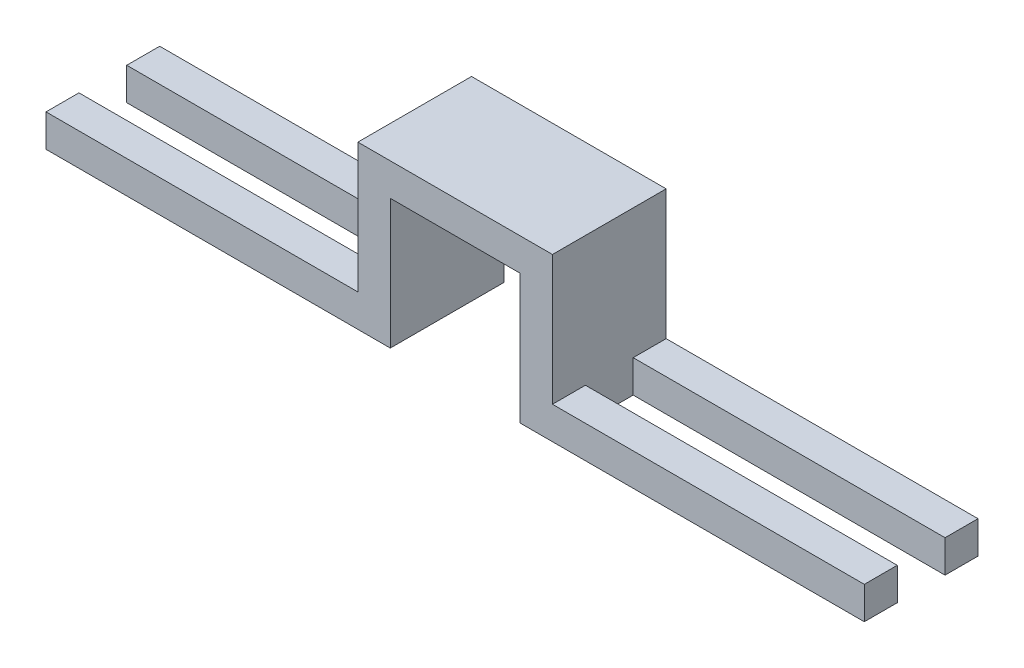
from build123d import *

# Parameters (mm, degrees)
BOSS_EXTRUDE1_DEPTH     = 17.526
CUT_EXTRUDE1_DEPTH      = 69.450165313
CUT_EXTRUDE1_DEPTH_BACK = 69.450165313
SKETCH2_W               = 8.819814413
SKETCH2_H               = 7.366
SKETCH2_W_2             = 48.073484567
SKETCH2_W_3             = 56.89329898


with BuildPart() as part:
    # Sketch1 → Boss-Extrude1 (new body)
    with BuildSketch(Plane.XY):
        Polygon((10, -10), (15, -10), (63.073484567, -10), (63.073484567, -5), (15, -5), (15, 15), (-15, 15), (-15, -5), (-63.073484567, -5), (-63.073484567, -10), (-15, -10), (-10, -10), (-10, 10), (10, 10), align=None)
    extrude(amount=BOSS_EXTRUDE1_DEPTH)

    # Sketch2 → Cut-Extrude1 (cut, two sides: drawn at the far end of the back side and taken through both)
    with BuildSketch(Plane(origin=(0, -5, 0), x_dir=(1, 0, 0), z_dir=(0, 1, 0)).offset(-CUT_EXTRUDE1_DEPTH_BACK)):
        with Locations((-67.483391774, -8.763)):
            Rectangle(SKETCH2_W, SKETCH2_H)
        with Locations((-39.036742284, -8.763)):
            Rectangle(SKETCH2_W_2, SKETCH2_H)
        with Locations((43.44664949, -8.763)):
            Rectangle(SKETCH2_W_3, SKETCH2_H)
    extrude(amount=CUT_EXTRUDE1_DEPTH + CUT_EXTRUDE1_DEPTH_BACK, mode=Mode.SUBTRACT)


solid = part.part
